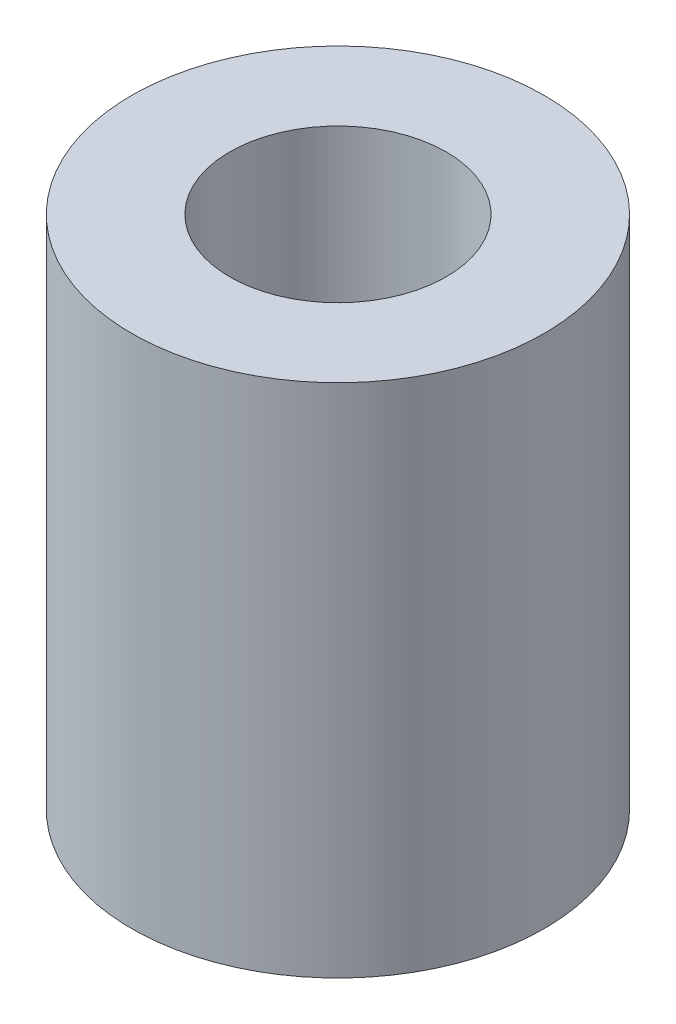
from build123d import *

# Parameters (mm, degrees)
ESQUISSE1_W = 1.9
ESQUISSE1_H = 10


with BuildPart() as part:
    # Esquisse1 → Révolution1 (revolve)
    with BuildSketch(Plane.XY, mode=Mode.PRIVATE) as r_volution1_sk:
        with Locations((-3.05, 5)):
            Rectangle(ESQUISSE1_W, ESQUISSE1_H)
    revolve(r_volution1_sk.sketch.rotate(Axis((0, 0, 0), (0, 1, 0)), 270), axis=Axis((0, 0, 0), (0, 1, 0)))


solid = part.part
